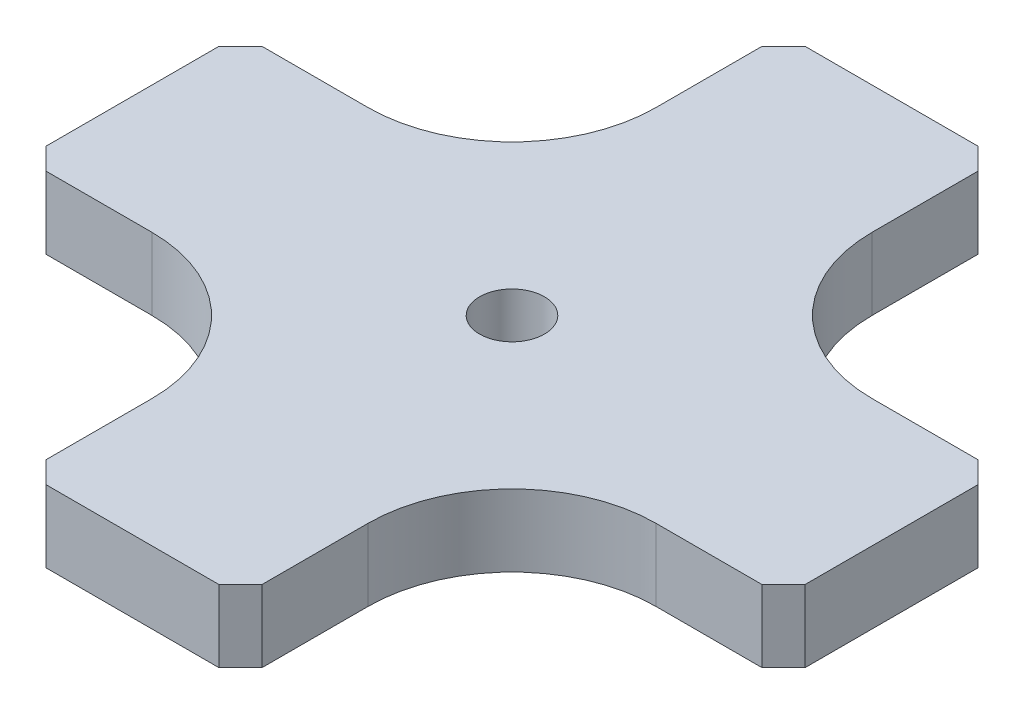
from build123d import *

# Parameters (mm, degrees)
BOSS_EXTRUDE1_DEPTH      = 2.5
FILLET1_R                = 10
CHAMFER1_SIZE            = 1.5
M4_CLEARANCE_HOLE1_D     = 4.5
M4_CLEARANCE_HOLE1_DEPTH = 5.2
M4_CLEARANCE_HOLE1_TIP   = 1.351936393


with BuildPart() as part:
    # Sketch2 → Boss-Extrude1 (new, symmetric)
    with BuildSketch(Plane(origin=(0, 0, 0), x_dir=(1, 0, 0), z_dir=(0, 1, 0))):
        Polygon((-7.5, 26.35), (7.5, 26.35), (7.5, 7.5), (26.35, 7.5), (26.35, -7.5), (7.5, -7.5), (7.5, -26.35), (-7.5, -26.35), (-7.5, -7.5), (-26.35, -7.5), (-26.35, 7.5), (-7.5, 7.5), align=None)
    extrude(amount=BOSS_EXTRUDE1_DEPTH, both=True)

    # Fillet1
    fillet1_edges = [part.edges().sort_by_distance(p)[0] for p in [
        (7.5, 0, 7.5),
        (-7.5, 0, 7.5),
        (-7.5, 0, -7.5),
        (7.5, 0, -7.5),
    ]]
    fillet(fillet1_edges, radius=FILLET1_R)

    # Chamfer1
    chamfer1_edges = [part.edges().sort_by_distance(p)[0] for p in [
        (26.35, 0, -7.5),
        (26.35, 0, 7.5),
        (7.5, 0, 26.35),
        (-7.5, 0, 26.35),
        (-26.35, 0, 7.5),
        (-26.35, 0, -7.5),
        (-7.5, 0, -26.35),
        (7.5, 0, -26.35),
    ]]
    chamfer(chamfer1_edges, length=CHAMFER1_SIZE)

    # M4 Clearance Hole1
    with Locations(Plane(origin=(0, 2.5, 0), x_dir=(1, 0, 0), z_dir=(0, 1, 0))):
        with Locations((0, 0)):
            Hole(M4_CLEARANCE_HOLE1_D / 2, depth=M4_CLEARANCE_HOLE1_DEPTH)
            with Locations((0, 0, -(M4_CLEARANCE_HOLE1_DEPTH + M4_CLEARANCE_HOLE1_TIP / 2))):  # 118° drill point
                Cone(0, M4_CLEARANCE_HOLE1_D / 2, M4_CLEARANCE_HOLE1_TIP, mode=Mode.SUBTRACT)


solid = part.part
